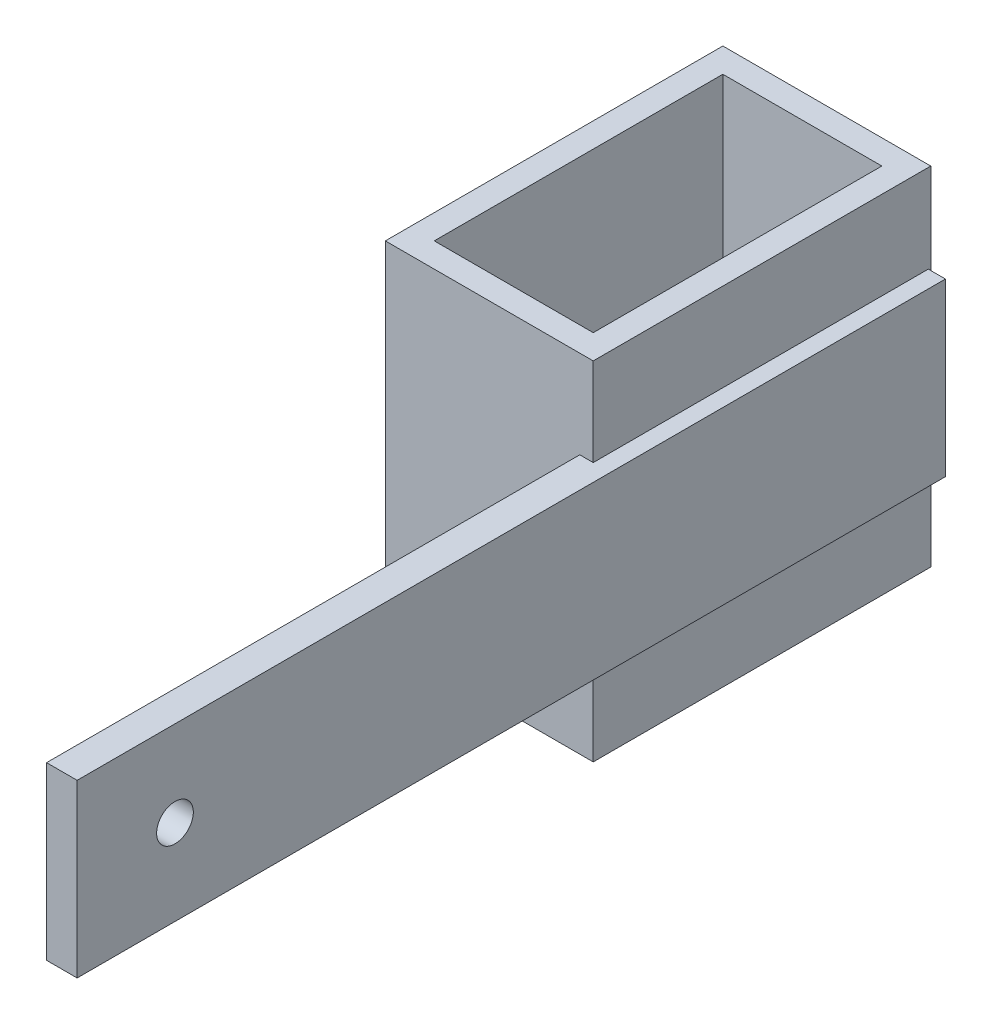
from build123d import *

# Parameters (mm, degrees)
S_BOX1_W       = 2.5
S_BOX1_H       = 14
BOSS_1_DEPTH   = 71
S_BOX2_W       = 17
S_BOX2_H       = 28.4
BOSS_2_DEPTH   = 27.6
S_CUT3_W       = 13
S_CUT3_H       = 28.6
POCKET_3_DEPTH = 23.6
S_HOLE4_R      = 1.5
HOLE_4_DEPTH   = 2.7


with BuildPart() as part:
    # S_box1 → Boss_1 (new body)
    with BuildSketch(Plane.XY.offset(-63)):
        with Locations((16.65, 0)):
            Rectangle(S_BOX1_W, S_BOX1_H)
    extrude(amount=BOSS_1_DEPTH)

    # S_box2 → Boss_2 (add)
    with BuildSketch(Plane.XY.offset(-63.2)):
        with Locations((8, 0)):
            Rectangle(S_BOX2_W, S_BOX2_H)
    extrude(amount=BOSS_2_DEPTH)

    # S_cut3 → Pocket_3 (cut)
    with BuildSketch(Plane.XY.offset(-61.2)):
        with Locations((8, 0)):
            Rectangle(S_CUT3_W, S_CUT3_H)
    extrude(amount=POCKET_3_DEPTH, mode=Mode.SUBTRACT)

    # S_hole4 → Hole_4 (cut)
    with BuildSketch(Plane(origin=(15.3, 0, 0), x_dir=(0, 0, -1), z_dir=(1, 0, 0))):
        with Locations(Location((0, 0, 0), (0, 0, 180))):
            Circle(S_HOLE4_R)
    extrude(amount=HOLE_4_DEPTH, mode=Mode.SUBTRACT)


solid = part.part
